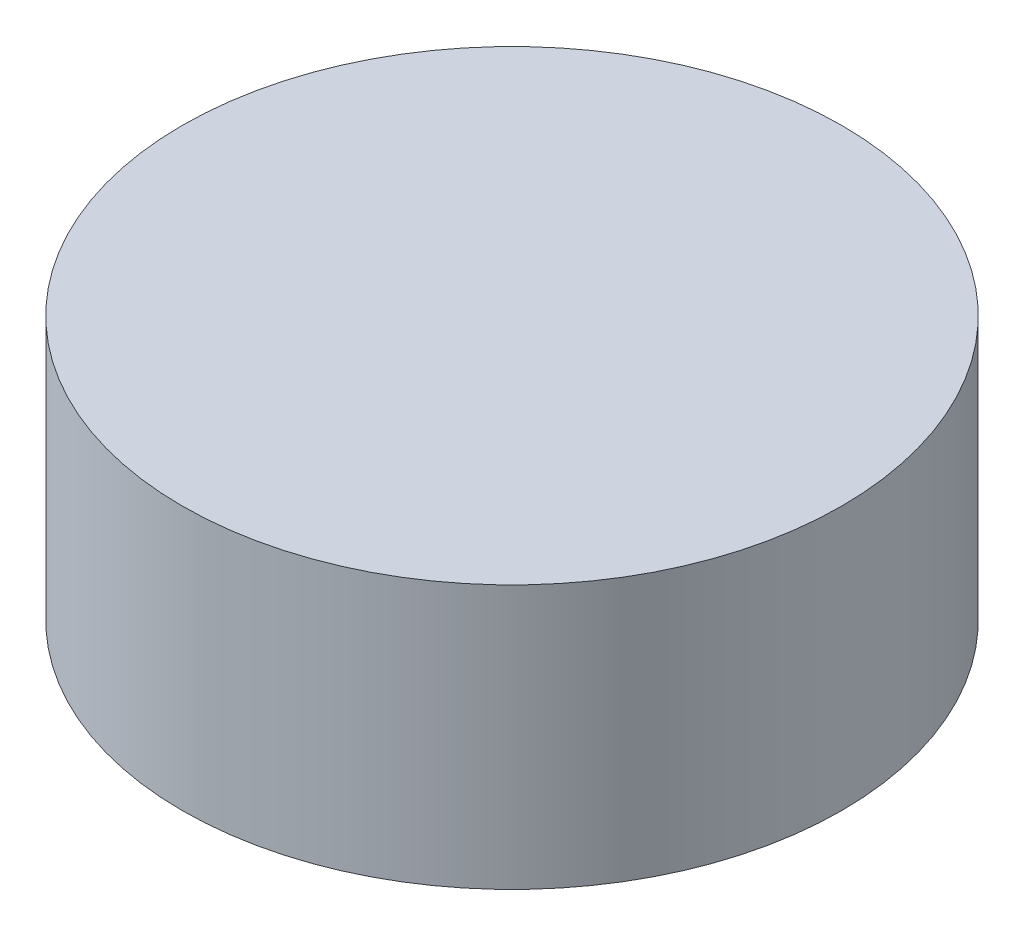
from build123d import *

# Parameters (mm, degrees)
SKETCH6_R      = 12.7
EXTRUDE5_DEPTH = 10.16


with BuildPart() as part:
    # Sketch6 → Extrude5 (new body)
    with BuildSketch(Plane(origin=(0, 0, 0), x_dir=(1, 0, 0), z_dir=(0, 1, 0))):
        with Locations(Location((0, 0, 0), (0, 0, 270))):
            Circle(SKETCH6_R)
    extrude(amount=-EXTRUDE5_DEPTH)


solid = part.part
